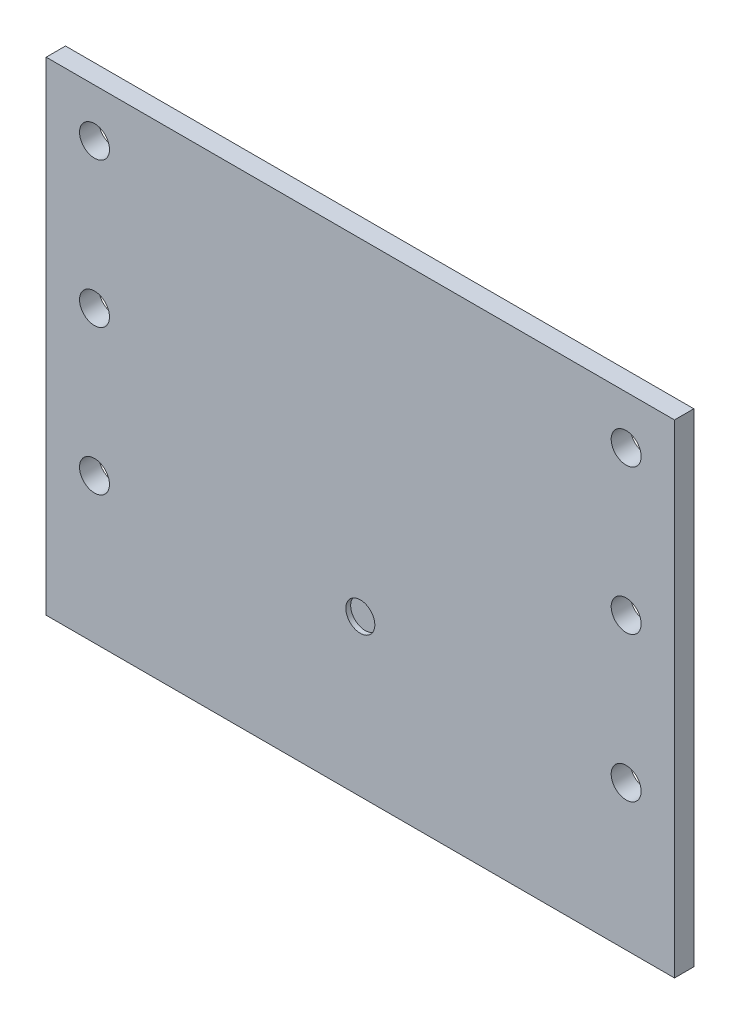
from build123d import *

# Parameters (mm, degrees)
SKETCH_2_W            = 210
SKETCH_2_H            = 100
EXTRUDE_1_DEPTH       = 4
SKETCH_7_R            = 3
CUT_EXTRUDE_2_DEPTH   = 1
SKETCH_8_R            = 3.1
CUT_EXTRUDE_3_DEPTH   = 60
SKETCH_11_OUTSIDE_W   = 258.526
SKETCH_11_OUTSIDE_H   = 148.526
SKETCH_11_OUTSIDE_W_2 = 130
SKETCH_11_OUTSIDE_H_2 = 100
SKETCH_11_OUTSIDE_R   = 3.1
CUT_EXTRUDE_5_DEPTH   = 100


with BuildPart() as part:
    # 草图2 → 凸台-拉伸1 (new body)
    with BuildSketch(Plane.XY):
        Rectangle(SKETCH_2_W, SKETCH_2_H)
    extrude(amount=EXTRUDE_1_DEPTH)

    # 草图7 → 切除-拉伸2 (cut)
    with BuildSketch(Plane.XY.offset(4)):
        with Locations((0, -17.737584897)):
            Circle(SKETCH_7_R)
    extrude(amount=-CUT_EXTRUDE_2_DEPTH, mode=Mode.SUBTRACT)

    # 草图8 → 切除-拉伸3 (cut)
    with BuildSketch(Plane.XY.offset(4)):
        with Locations((-55, 10)):
            Circle(SKETCH_8_R)
        with Locations((-55, 40)):
            Circle(SKETCH_8_R)
        with Locations((-55, -20)):
            Circle(SKETCH_8_R)
        with Locations((55, 40)):
            Circle(SKETCH_8_R)
        with Locations((55, 10)):
            Circle(SKETCH_8_R)
        with Locations((55, -20)):
            Circle(SKETCH_8_R)
    extrude(amount=-CUT_EXTRUDE_3_DEPTH, mode=Mode.SUBTRACT)

    # 草图11 outside → 切除-拉伸5 (cut)
    # profile 1 of 2: a face of its own
    with BuildSketch(Plane(origin=(0, 0, 0), x_dir=(-1, 0, 0), z_dir=(0, 0, -1))):
        Rectangle(SKETCH_11_OUTSIDE_W, SKETCH_11_OUTSIDE_H)
        Rectangle(SKETCH_11_OUTSIDE_W_2, SKETCH_11_OUTSIDE_H_2, mode=Mode.SUBTRACT)
    # profile 2 of 2: a face of its own
    with BuildSketch(Plane(origin=(0, 0, 0), x_dir=(-1, 0, 0), z_dir=(0, 0, -1))):
        with Locations(Location((55, 40, 0), (0, 0, 180))):
            Circle(SKETCH_11_OUTSIDE_R)
    extrude(amount=-CUT_EXTRUDE_5_DEPTH, mode=Mode.SUBTRACT)


solid = part.part
